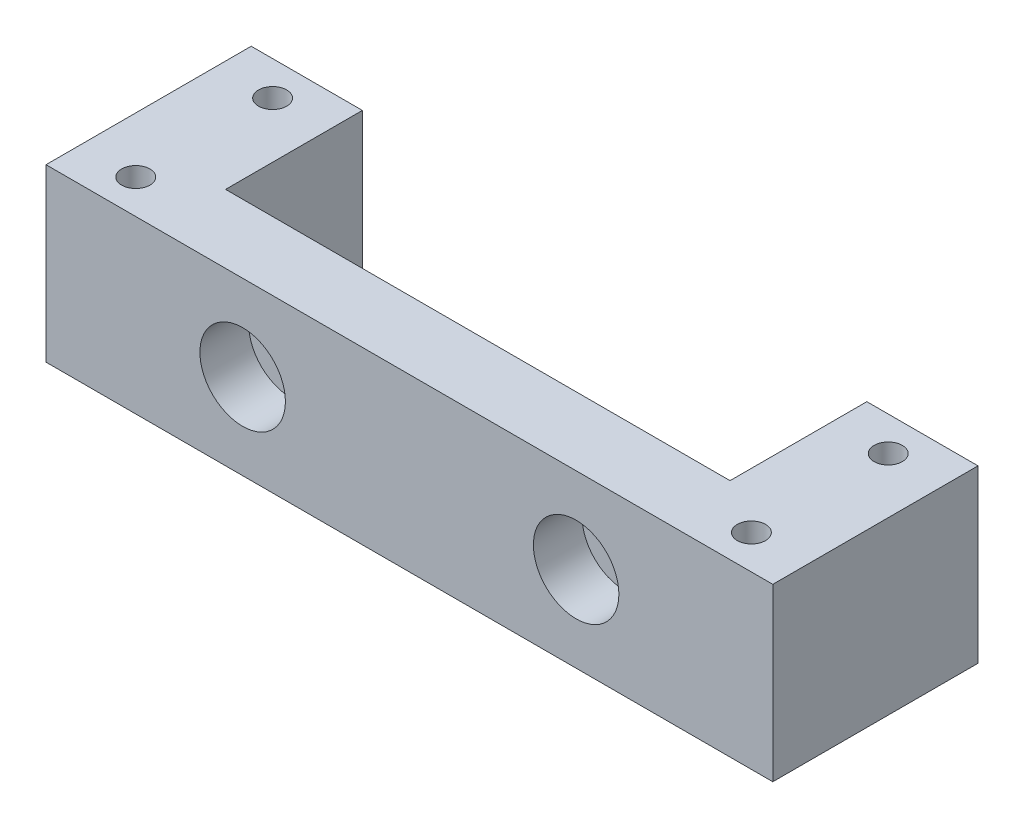
from build123d import *

# Parameters (mm, degrees)
EXTRUDE_1_DEPTH           = 20
HOLE_WIZARD_0_D           = 5.5
HOLE_WIZARD_0_CBORE_D     = 10
HOLE_WIZARD_0_CBORE_DEPTH = 5.7
HOLE_WIZARD_M4_1_D        = 3.3


with BuildPart() as part:
    # 草图1 → 凸台-拉伸1 (new body)
    with BuildSketch(Plane(origin=(0, 0, 0), x_dir=(1, 0, 0), z_dir=(0, 1, 0))):
        Polygon((-42.5, 24), (-29.5, 24), (-29.5, 8), (29.5, 8), (29.5, 24), (42.5, 24), (42.5, 0), (-42.5, 0), align=None)
    extrude(amount=EXTRUDE_1_DEPTH)

    # 打孔尺寸(%根据)内六角圆柱头螺钉的类型0 (through all)
    with Locations(Plane.XY):
        with Locations((19.5, 10), (-19.5, 10)):
            CounterBoreHole(HOLE_WIZARD_0_D / 2, HOLE_WIZARD_0_CBORE_D / 2, HOLE_WIZARD_0_CBORE_DEPTH)

    # M4 螺纹孔1 (through all)
    with Locations(Plane(origin=(0, 0, 0), x_dir=(-1, 0, 0), z_dir=(0, -1, 0))):
        with Locations((36, 4), (-36, 4), (36, 20), (-36, 20)):
            Hole(HOLE_WIZARD_M4_1_D / 2)


solid = part.part
